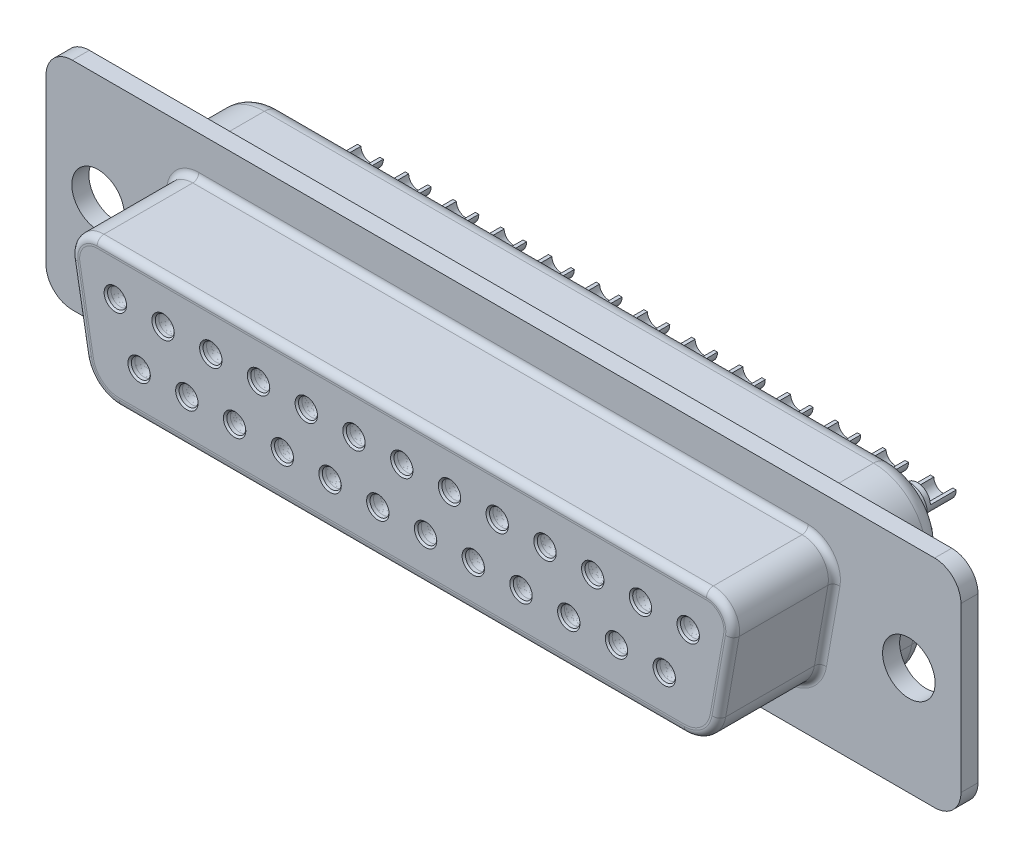
from build123d import *

# Parameters (mm, degrees)
SKETCH3_R                   = 1.524
FLANGE_DEPTH                = 0.99
FRONT_STEEL_HOUSING_DEPTH   = 5.9
FILLET1_R                   = 0.4
FILLET2_R                   = 0.35
REAR_STEEL_HOUSING_DEPTH    = 3.81
INSERT_CUTOUT_DEPTH         = 30.298146963
PLASTIC_INSERT_DEPTH        = 10.7
PLASTIC_INSERT_DEPTH_BACK   = 1.1
FILLET3_R                   = 1
FILLET4_R                   = 0.4
SKETCH9_R                   = 0.55
CUT_EXTRUDE2_DEPTH          = 30.717527075
SKETCH10_R                  = 0.75
SKETCH10_R_2                = 0.55
F_13_SOLDER_PINS_DEPTH      = 3
SOLDER_PIN_SHAPE_DEPTH      = 1.5
LPATTERN1_COUNT             = 13
LPATTERN1_PITCH             = 2.77
SKETCH13_R                  = 0.75
SKETCH13_R_2                = 0.55
F_12_SOLDER_PINS_DEPTH      = 3
F_12_SOLDER_PIN_SHAPE_DEPTH = 1.5
LPATTERN2_COUNT             = 12
LPATTERN2_PITCH             = 2.77
SKETCH15_R                  = 0.75
SKETCH15_R_2                = 0.55
BOSS_EXTRUDE7_DEPTH         = 11.5
BOSS_EXTRUDE7_2_DEPTH       = 11.5
BOSS_EXTRUDE7_3_DEPTH       = 11.5
BOSS_EXTRUDE7_4_DEPTH       = 11.5
BOSS_EXTRUDE7_5_DEPTH       = 11.5
BOSS_EXTRUDE7_6_DEPTH       = 11.5
BOSS_EXTRUDE7_7_DEPTH       = 11.5
BOSS_EXTRUDE7_8_DEPTH       = 11.5
BOSS_EXTRUDE7_9_DEPTH       = 11.5
BOSS_EXTRUDE7_10_DEPTH      = 11.5
BOSS_EXTRUDE7_11_DEPTH      = 11.5
BOSS_EXTRUDE7_12_DEPTH      = 11.5
BOSS_EXTRUDE7_13_DEPTH      = 11.5
BOSS_EXTRUDE7_14_DEPTH      = 11.5
BOSS_EXTRUDE7_15_DEPTH      = 11.5
BOSS_EXTRUDE7_16_DEPTH      = 11.5
BOSS_EXTRUDE7_17_DEPTH      = 11.5
BOSS_EXTRUDE7_18_DEPTH      = 11.5
BOSS_EXTRUDE7_19_DEPTH      = 11.5
BOSS_EXTRUDE7_20_DEPTH      = 11.5
BOSS_EXTRUDE7_21_DEPTH      = 11.5
BOSS_EXTRUDE7_22_DEPTH      = 11.5
BOSS_EXTRUDE7_23_DEPTH      = 11.5
BOSS_EXTRUDE7_24_DEPTH      = 11.5
BOSS_EXTRUDE7_25_DEPTH      = 11.5
CHAMFER1_SIZE               = 0.1


with BuildPart() as part:
    # Sketch3 → Flange (new body)
    with BuildSketch(Plane.XY):
        with BuildLine():
            Line((25.019, 6.2738), (-25.019, 6.2738))
            ThreePointArc((-25.019, 6.2738), (-26.096630735, 5.827430735), (-26.543, 4.7498))
            Line((-26.543, 4.7498), (-26.543, -4.7498))
            ThreePointArc((-26.543, -4.7498), (-26.096630735, -5.827430735), (-25.019, -6.2738))
            Line((-25.019, -6.2738), (25.019, -6.2738))
            ThreePointArc((25.019, -6.2738), (26.096630735, -5.827430735), (26.543, -4.7498))
            Line((26.543, -4.7498), (26.543, 4.7498))
            ThreePointArc((26.543, 4.7498), (26.096630735, 5.827430735), (25.019, 6.2738))
        make_face()
        with Locations((-23.5204, 0)):
            Circle(SKETCH3_R, mode=Mode.SUBTRACT)
        with Locations((23.5204, 0)):
            Circle(SKETCH3_R, mode=Mode.SUBTRACT)
    extrude(amount=FLANGE_DEPTH)

    # Sketch5 → Front Steel Housing (add)
    with BuildSketch(Plane.XY.offset(6.89)):
        with BuildLine():
            Line((17.676152984, 3.9497), (-17.676152984, 3.9497))
            ThreePointArc((-17.676152984, 3.9497), (-18.753783719, 3.503330735), (-19.200152984, 2.4257))
            ThreePointArc((-19.200152984, 2.4257), (-19.194353704, 2.292874648), (-19.177, 2.161060177))
            Line((-19.177, 2.161060177), (-18.395587012, -2.270553097))
            ThreePointArc((-18.395587012, -2.270553097), (-17.70060208, -3.474302308), (-16.394457658, -3.9497))
            Line((-16.394457658, -3.9497), (16.394457658, -3.9497))
            ThreePointArc((16.394457658, -3.9497), (17.70060208, -3.474302308), (18.395587012, -2.270553097))
            Line((18.395587012, -2.270553097), (19.177, 2.161060177))
            ThreePointArc((19.177, 2.161060177), (18.843604716, 3.405308317), (17.676152984, 3.9497))
        make_face()
    extrude(amount=-FRONT_STEEL_HOUSING_DEPTH)

    # Fillet1
    fillet1_edges = [part.edges().sort_by_distance(p)[0] for p in [
        (18.843604716, 3.405308317, 6.89),
        (0, 3.9497, 6.89),
        (-18.843604716, 3.405308317, 6.89),
        (-18.786293506, -0.05474646, 6.89),
        (-17.70060208, -3.474302308, 6.89),
        (0, -3.9497, 6.89),
        (17.70060208, -3.474302308, 6.89),
        (18.786293506, -0.05474646, 6.89),
    ]]
    fillet(fillet1_edges, radius=FILLET1_R)

    # Fillet2
    fillet2_edges = [part.edges().sort_by_distance(p)[0] for p in [
        (18.843604716, 3.405308317, 0.99),
        (18.786293506, -0.05474646, 0.99),
        (17.70060208, -3.474302308, 0.99),
        (0, -3.9497, 0.99),
        (-17.70060208, -3.474302308, 0.99),
        (-18.786293506, -0.05474646, 0.99),
        (-18.843604716, 3.405308317, 0.99),
        (0, 3.9497, 0.99),
    ]]
    fillet(fillet2_edges, radius=FILLET2_R)

    # Sketch7 → Rear Steel Housing (add)
    with BuildSketch(Plane.XY.offset(-3.81)):
        with BuildLine():
            Line((17.676152984, 5.4737), (-17.676152984, 5.4737))
            ThreePointArc((-17.676152984, 5.4737), (-19.831414453, 4.580961469), (-20.724152984, 2.4257))
            ThreePointArc((-20.724152984, 2.4257), (-20.712554424, 2.160049296), (-20.677847016, 1.896420354))
            Line((-20.677847016, 1.896420354), (-19.896434027, -2.53519292))
            ThreePointArc((-19.896434027, -2.53519292), (-18.680210398, -4.64175404), (-16.394457658, -5.4737))
            Line((-16.394457658, -5.4737), (16.394457658, -5.4737))
            ThreePointArc((16.394457658, -5.4737), (18.680210398, -4.64175404), (19.896434027, -2.53519292))
            Line((19.896434027, -2.53519292), (20.677847016, 1.896420354))
            ThreePointArc((20.677847016, 1.896420354), (20.712554424, 2.160049296), (20.724152984, 2.4257))
            ThreePointArc((20.724152984, 2.4257), (19.831414453, 4.580961469), (17.676152984, 5.4737))
        make_face()
    extrude(amount=REAR_STEEL_HOUSING_DEPTH)

    # Sketch6 → Insert Cutout (cut, through all)
    with BuildSketch(Plane.XY.offset(6.89)):
        with BuildLine():
            Line((17.676152984, 3.4417), (-17.676152984, 3.4417))
            ThreePointArc((-17.676152984, 3.4417), (-18.394573474, 3.14412049), (-18.692152984, 2.4257))
            ThreePointArc((-18.692152984, 2.4257), (-18.688286798, 2.337149765), (-18.676717661, 2.249273451))
            Line((-18.676717661, 2.249273451), (-17.895304673, -2.182339823))
            ThreePointArc((-17.895304673, -2.182339823), (-17.374065975, -3.085151731), (-16.394457658, -3.4417))
            Line((-16.394457658, -3.4417), (16.394457658, -3.4417))
            ThreePointArc((16.394457658, -3.4417), (17.374065975, -3.085151731), (17.895304673, -2.182339823))
            Line((17.895304673, -2.182339823), (18.676717661, 2.249273451))
            ThreePointArc((18.676717661, 2.249273451), (18.454454139, 3.078772211), (17.676152984, 3.4417))
        make_face()
    extrude(amount=-INSERT_CUTOUT_DEPTH, mode=Mode.SUBTRACT)

    # Fillet3
    fillet3_edges = [part.edges().sort_by_distance(p)[0] for p in [
        (20.011056447, 4.384916634, -3.81),
        (0, 5.4737, -3.81),
        (-20.011056447, 4.384916634, -3.81),
        (-20.287140521, -0.319386283, -3.81),
        (-18.680210398, -4.64175404, -3.81),
        (0, -5.4737, -3.81),
        (18.680210398, -4.64175404, -3.81),
        (20.287140521, -0.319386283, -3.81),
    ]]
    fillet(fillet3_edges, radius=FILLET3_R)

    # Fillet4
    fillet4_edges = [part.edges().sort_by_distance(p)[0] for p in [
        (20.011056447, 4.384916634, 0),
        (0, 5.4737, 0),
        (-20.011056447, 4.384916634, 0),
        (-20.287140521, -0.319386283, 0),
        (-18.680210398, -4.64175404, 0),
        (0, -5.4737, 0),
        (18.680210398, -4.64175404, 0),
        (20.287140521, -0.319386283, 0),
    ]]
    fillet(fillet4_edges, radius=FILLET4_R)


with BuildPart() as body_2:
    # Sketch8 → Plastic Insert (new, two sides: drawn at the far end of the back side and taken through both)
    with BuildSketch(Plane.XY.offset(-3.81).offset(-PLASTIC_INSERT_DEPTH_BACK)):
        with BuildLine():
            Line((17.676152984, 3.4417), (-17.676152984, 3.4417))
            ThreePointArc((-17.676152984, 3.4417), (-18.394573474, 3.14412049), (-18.692152984, 2.4257))
            ThreePointArc((-18.692152984, 2.4257), (-18.688286798, 2.337149765), (-18.676717661, 2.249273451))
            Line((-18.676717661, 2.249273451), (-17.895304673, -2.182339823))
            ThreePointArc((-17.895304673, -2.182339823), (-17.374065975, -3.085151731), (-16.394457658, -3.4417))
            Line((-16.394457658, -3.4417), (16.394457658, -3.4417))
            ThreePointArc((16.394457658, -3.4417), (17.374065975, -3.085151731), (17.895304673, -2.182339823))
            Line((17.895304673, -2.182339823), (18.676717661, 2.249273451))
            ThreePointArc((18.676717661, 2.249273451), (18.454454139, 3.078772211), (17.676152984, 3.4417))
        make_face()
    extrude(amount=PLASTIC_INSERT_DEPTH + PLASTIC_INSERT_DEPTH_BACK)

    # Sketch9 → Cut-Extrude2 (cut, through all)
    with BuildSketch(Plane.XY.offset(6.89)):
        with Locations((0, 1.42)):
            Circle(SKETCH9_R)
        with Locations((2.77, 1.42)):
            Circle(SKETCH9_R)
        with Locations((5.54, 1.42)):
            Circle(SKETCH9_R)
        with Locations((8.31, 1.42)):
            Circle(SKETCH9_R)
        with Locations((11.08, 1.42)):
            Circle(SKETCH9_R)
        with Locations((13.85, 1.42)):
            Circle(SKETCH9_R)
        with Locations((16.62, 1.42)):
            Circle(SKETCH9_R)
        with Locations((-2.77, 1.42)):
            Circle(SKETCH9_R)
        with Locations((-5.54, 1.42)):
            Circle(SKETCH9_R)
        with Locations((-8.31, 1.42)):
            Circle(SKETCH9_R)
        with Locations((-11.08, 1.42)):
            Circle(SKETCH9_R)
        with Locations((-13.85, 1.42)):
            Circle(SKETCH9_R)
        with Locations((-16.62, 1.42)):
            Circle(SKETCH9_R)
        with Locations((1.38, -1.42)):
            Circle(SKETCH9_R)
        with Locations((4.15, -1.42)):
            Circle(SKETCH9_R)
        with Locations((6.92, -1.42)):
            Circle(SKETCH9_R)
        with Locations((9.69, -1.42)):
            Circle(SKETCH9_R)
        with Locations((12.46, -1.42)):
            Circle(SKETCH9_R)
        with Locations((15.23, -1.42)):
            Circle(SKETCH9_R)
        with Locations((-1.39, -1.42)):
            Circle(SKETCH9_R)
        with Locations((-4.16, -1.42)):
            Circle(SKETCH9_R)
        with Locations((-6.93, -1.42)):
            Circle(SKETCH9_R)
        with Locations((-9.7, -1.42)):
            Circle(SKETCH9_R)
        with Locations((-12.47, -1.42)):
            Circle(SKETCH9_R)
        with Locations((-15.24, -1.42)):
            Circle(SKETCH9_R)
    extrude(amount=-CUT_EXTRUDE2_DEPTH, mode=Mode.SUBTRACT)

    # Sketch10 → 13 Solder Pins (add)
    with BuildSketch(Plane.XY.offset(-4.91)):
        with Locations((16.62, 1.42)):
            Circle(SKETCH10_R)
        with Locations((16.62, 1.42)):
            Circle(SKETCH10_R_2, mode=Mode.SUBTRACT)
    f_13_solder_pins = extrude(amount=-F_13_SOLDER_PINS_DEPTH)

    # Sketch12 → Solder Pin Shape (cut)
    with BuildSketch(Plane(origin=(0, 0, -7.91), x_dir=(-1, 0, 0), z_dir=(0, 0, -1))):
        with BuildLine():
            Line((-17.37, 1.42), (-15.87, 1.42))
            ThreePointArc((-15.87, 1.42), (-16.62, 2.17), (-17.37, 1.42))
        make_face()
    solder_pin_shape = extrude(amount=-SOLDER_PIN_SHAPE_DEPTH, mode=Mode.SUBTRACT)

    # LPattern1: 13 Solder Pins, Solder Pin Shape ×13
    with Locations(*[(-i * LPATTERN1_PITCH, 0, 0) for i in range(1, LPATTERN1_COUNT)]):
        add(f_13_solder_pins)
        add(solder_pin_shape, mode=Mode.SUBTRACT)

    # Sketch13 → 12 Solder Pins (add)
    with BuildSketch(Plane.XY.offset(-4.91)):
        with Locations((15.23, -1.42)):
            Circle(SKETCH13_R)
        with Locations((15.23, -1.42)):
            Circle(SKETCH13_R_2, mode=Mode.SUBTRACT)
    f_12_solder_pins = extrude(amount=-F_12_SOLDER_PINS_DEPTH)

    # Sketch14 → 12 Solder Pin Shape (cut)
    with BuildSketch(Plane(origin=(0, 0, -7.91), x_dir=(-1, 0, 0), z_dir=(0, 0, -1))):
        with BuildLine():
            Line((-15.98, -1.42), (-14.48, -1.42))
            ThreePointArc((-14.48, -1.42), (-15.23, -2.17), (-15.98, -1.42))
        make_face()
    f_12_solder_pin_shape = extrude(amount=-F_12_SOLDER_PIN_SHAPE_DEPTH, mode=Mode.SUBTRACT)

    # LPattern2: 12 Solder Pins, 12 Solder Pin Shape ×12
    with Locations(*[(-i * LPATTERN2_PITCH, 0, 0) for i in range(1, LPATTERN2_COUNT)]):
        add(f_12_solder_pins)
        add(f_12_solder_pin_shape, mode=Mode.SUBTRACT)

    # Chamfer1
    chamfer1_edges = [body_2.edges().sort_by_distance(p)[0] for p in [
        (0.83, -1.42, 6.89),
        (3.6, -1.42, 6.89),
        (6.37, -1.42, 6.89),
        (9.14, -1.42, 6.89),
        (11.91, -1.42, 6.89),
        (14.68, -1.42, 6.89),
        (-1.94, -1.42, 6.89),
        (-4.71, -1.42, 6.89),
        (-7.48, -1.42, 6.89),
        (-10.25, -1.42, 6.89),
        (-13.02, -1.42, 6.89),
        (-15.79, -1.42, 6.89),
        (-0.55, 1.42, 6.89),
        (2.22, 1.42, 6.89),
        (4.99, 1.42, 6.89),
        (7.76, 1.42, 6.89),
        (10.53, 1.42, 6.89),
        (13.3, 1.42, 6.89),
        (16.07, 1.42, 6.89),
        (-3.32, 1.42, 6.89),
        (-6.09, 1.42, 6.89),
        (-8.86, 1.42, 6.89),
        (-11.63, 1.42, 6.89),
        (-14.4, 1.42, 6.89),
        (-17.17, 1.42, 6.89),
    ]]
    chamfer(chamfer1_edges, length=CHAMFER1_SIZE)


with BuildPart() as body_3:
    # Sketch15 → Boss-Extrude7 (new body)
    with BuildSketch(Plane.XY.offset(-4.91)):
        with Locations((16.62, 1.42)):
            Circle(SKETCH15_R)
        with Locations((16.62, 1.42)):
            Circle(SKETCH15_R_2, mode=Mode.SUBTRACT)
    extrude(amount=BOSS_EXTRUDE7_DEPTH)


with BuildPart() as body_4:
    # Sketch15 → Boss-Extrude7 2 (new body)
    with BuildSketch(Plane.XY.offset(-4.91)):
        with Locations((13.85, 1.42)):
            Circle(SKETCH15_R)
        with Locations((13.85, 1.42)):
            Circle(SKETCH15_R_2, mode=Mode.SUBTRACT)
    extrude(amount=BOSS_EXTRUDE7_2_DEPTH)


with BuildPart() as body_5:
    # Sketch15 → Boss-Extrude7 3 (new body)
    with BuildSketch(Plane.XY.offset(-4.91)):
        with Locations((11.08, 1.42)):
            Circle(SKETCH15_R)
        with Locations((11.08, 1.42)):
            Circle(SKETCH15_R_2, mode=Mode.SUBTRACT)
    extrude(amount=BOSS_EXTRUDE7_3_DEPTH)


with BuildPart() as body_6:
    # Sketch15 → Boss-Extrude7 4 (new body)
    with BuildSketch(Plane.XY.offset(-4.91)):
        with Locations((8.31, 1.42)):
            Circle(SKETCH15_R)
        with Locations((8.31, 1.42)):
            Circle(SKETCH15_R_2, mode=Mode.SUBTRACT)
    extrude(amount=BOSS_EXTRUDE7_4_DEPTH)


with BuildPart() as body_7:
    # Sketch15 → Boss-Extrude7 5 (new body)
    with BuildSketch(Plane.XY.offset(-4.91)):
        with Locations((5.54, 1.42)):
            Circle(SKETCH15_R)
        with Locations((5.54, 1.42)):
            Circle(SKETCH15_R_2, mode=Mode.SUBTRACT)
    extrude(amount=BOSS_EXTRUDE7_5_DEPTH)


with BuildPart() as body_8:
    # Sketch15 → Boss-Extrude7 6 (new body)
    with BuildSketch(Plane.XY.offset(-4.91)):
        with Locations((2.77, 1.42)):
            Circle(SKETCH15_R)
        with Locations((2.77, 1.42)):
            Circle(SKETCH15_R_2, mode=Mode.SUBTRACT)
    extrude(amount=BOSS_EXTRUDE7_6_DEPTH)


with BuildPart() as body_9:
    # Sketch15 → Boss-Extrude7 7 (new body)
    with BuildSketch(Plane.XY.offset(-4.91)):
        with Locations((0, 1.42)):
            Circle(SKETCH15_R)
        with Locations((0, 1.42)):
            Circle(SKETCH15_R_2, mode=Mode.SUBTRACT)
    extrude(amount=BOSS_EXTRUDE7_7_DEPTH)


with BuildPart() as body_10:
    # Sketch15 → Boss-Extrude7 8 (new body)
    with BuildSketch(Plane.XY.offset(-4.91)):
        with Locations((-2.77, 1.42)):
            Circle(SKETCH15_R)
        with Locations((-2.77, 1.42)):
            Circle(SKETCH15_R_2, mode=Mode.SUBTRACT)
    extrude(amount=BOSS_EXTRUDE7_8_DEPTH)


with BuildPart() as body_11:
    # Sketch15 → Boss-Extrude7 9 (new body)
    with BuildSketch(Plane.XY.offset(-4.91)):
        with Locations((-5.54, 1.42)):
            Circle(SKETCH15_R)
        with Locations((-5.54, 1.42)):
            Circle(SKETCH15_R_2, mode=Mode.SUBTRACT)
    extrude(amount=BOSS_EXTRUDE7_9_DEPTH)


with BuildPart() as body_12:
    # Sketch15 → Boss-Extrude7 10 (new body)
    with BuildSketch(Plane.XY.offset(-4.91)):
        with Locations((-8.31, 1.42)):
            Circle(SKETCH15_R)
        with Locations((-8.31, 1.42)):
            Circle(SKETCH15_R_2, mode=Mode.SUBTRACT)
    extrude(amount=BOSS_EXTRUDE7_10_DEPTH)


with BuildPart() as body_13:
    # Sketch15 → Boss-Extrude7 11 (new body)
    with BuildSketch(Plane.XY.offset(-4.91)):
        with Locations((-11.08, 1.42)):
            Circle(SKETCH15_R)
        with Locations((-11.08, 1.42)):
            Circle(SKETCH15_R_2, mode=Mode.SUBTRACT)
    extrude(amount=BOSS_EXTRUDE7_11_DEPTH)


with BuildPart() as body_14:
    # Sketch15 → Boss-Extrude7 12 (new body)
    with BuildSketch(Plane.XY.offset(-4.91)):
        with Locations((-13.85, 1.42)):
            Circle(SKETCH15_R)
        with Locations((-13.85, 1.42)):
            Circle(SKETCH15_R_2, mode=Mode.SUBTRACT)
    extrude(amount=BOSS_EXTRUDE7_12_DEPTH)


with BuildPart() as body_15:
    # Sketch15 → Boss-Extrude7 13 (new body)
    with BuildSketch(Plane.XY.offset(-4.91)):
        with Locations((-16.62, 1.42)):
            Circle(SKETCH15_R)
        with Locations((-16.62, 1.42)):
            Circle(SKETCH15_R_2, mode=Mode.SUBTRACT)
    extrude(amount=BOSS_EXTRUDE7_13_DEPTH)


with BuildPart() as body_16:
    # Sketch15 → Boss-Extrude7 14 (new body)
    with BuildSketch(Plane.XY.offset(-4.91)):
        with Locations((15.23, -1.42)):
            Circle(SKETCH15_R)
        with Locations((15.23, -1.42)):
            Circle(SKETCH15_R_2, mode=Mode.SUBTRACT)
    extrude(amount=BOSS_EXTRUDE7_14_DEPTH)


with BuildPart() as body_17:
    # Sketch15 → Boss-Extrude7 15 (new body)
    with BuildSketch(Plane.XY.offset(-4.91)):
        with Locations((12.46, -1.42)):
            Circle(SKETCH15_R)
        with Locations((12.46, -1.42)):
            Circle(SKETCH15_R_2, mode=Mode.SUBTRACT)
    extrude(amount=BOSS_EXTRUDE7_15_DEPTH)


with BuildPart() as body_18:
    # Sketch15 → Boss-Extrude7 16 (new body)
    with BuildSketch(Plane.XY.offset(-4.91)):
        with Locations((9.69, -1.42)):
            Circle(SKETCH15_R)
        with Locations((9.69, -1.42)):
            Circle(SKETCH15_R_2, mode=Mode.SUBTRACT)
    extrude(amount=BOSS_EXTRUDE7_16_DEPTH)


with BuildPart() as body_19:
    # Sketch15 → Boss-Extrude7 17 (new body)
    with BuildSketch(Plane.XY.offset(-4.91)):
        with Locations((6.92, -1.42)):
            Circle(SKETCH15_R)
        with Locations((6.92, -1.42)):
            Circle(SKETCH15_R_2, mode=Mode.SUBTRACT)
    extrude(amount=BOSS_EXTRUDE7_17_DEPTH)


with BuildPart() as body_20:
    # Sketch15 → Boss-Extrude7 18 (new body)
    with BuildSketch(Plane.XY.offset(-4.91)):
        with Locations((4.15, -1.42)):
            Circle(SKETCH15_R)
        with Locations((4.15, -1.42)):
            Circle(SKETCH15_R_2, mode=Mode.SUBTRACT)
    extrude(amount=BOSS_EXTRUDE7_18_DEPTH)


with BuildPart() as body_21:
    # Sketch15 → Boss-Extrude7 19 (new body)
    with BuildSketch(Plane.XY.offset(-4.91)):
        with Locations((1.38, -1.42)):
            Circle(SKETCH15_R)
        with Locations((1.38, -1.42)):
            Circle(SKETCH15_R_2, mode=Mode.SUBTRACT)
    extrude(amount=BOSS_EXTRUDE7_19_DEPTH)


with BuildPart() as body_22:
    # Sketch15 → Boss-Extrude7 20 (new body)
    with BuildSketch(Plane.XY.offset(-4.91)):
        with Locations((-1.39, -1.42)):
            Circle(SKETCH15_R)
        with Locations((-1.39, -1.42)):
            Circle(SKETCH15_R_2, mode=Mode.SUBTRACT)
    extrude(amount=BOSS_EXTRUDE7_20_DEPTH)


with BuildPart() as body_23:
    # Sketch15 → Boss-Extrude7 21 (new body)
    with BuildSketch(Plane.XY.offset(-4.91)):
        with Locations((-4.16, -1.42)):
            Circle(SKETCH15_R)
        with Locations((-4.16, -1.42)):
            Circle(SKETCH15_R_2, mode=Mode.SUBTRACT)
    extrude(amount=BOSS_EXTRUDE7_21_DEPTH)


with BuildPart() as body_24:
    # Sketch15 → Boss-Extrude7 22 (new body)
    with BuildSketch(Plane.XY.offset(-4.91)):
        with Locations((-6.93, -1.42)):
            Circle(SKETCH15_R)
        with Locations((-6.93, -1.42)):
            Circle(SKETCH15_R_2, mode=Mode.SUBTRACT)
    extrude(amount=BOSS_EXTRUDE7_22_DEPTH)


with BuildPart() as body_25:
    # Sketch15 → Boss-Extrude7 23 (new body)
    with BuildSketch(Plane.XY.offset(-4.91)):
        with Locations((-9.7, -1.42)):
            Circle(SKETCH15_R)
        with Locations((-9.7, -1.42)):
            Circle(SKETCH15_R_2, mode=Mode.SUBTRACT)
    extrude(amount=BOSS_EXTRUDE7_23_DEPTH)


with BuildPart() as body_26:
    # Sketch15 → Boss-Extrude7 24 (new body)
    with BuildSketch(Plane.XY.offset(-4.91)):
        with Locations((-12.47, -1.42)):
            Circle(SKETCH15_R)
        with Locations((-12.47, -1.42)):
            Circle(SKETCH15_R_2, mode=Mode.SUBTRACT)
    extrude(amount=BOSS_EXTRUDE7_24_DEPTH)


with BuildPart() as body_27:
    # Sketch15 → Boss-Extrude7 25 (new body)
    with BuildSketch(Plane.XY.offset(-4.91)):
        with Locations((-15.24, -1.42)):
            Circle(SKETCH15_R)
        with Locations((-15.24, -1.42)):
            Circle(SKETCH15_R_2, mode=Mode.SUBTRACT)
    extrude(amount=BOSS_EXTRUDE7_25_DEPTH)


solid = Compound([part.part, body_2.part, body_3.part, body_4.part, body_5.part, body_6.part, body_7.part, body_8.part, body_9.part, body_10.part, body_11.part, body_12.part, body_13.part, body_14.part, body_15.part, body_16.part, body_17.part, body_18.part, body_19.part, body_20.part, body_21.part, body_22.part, body_23.part, body_24.part, body_25.part, body_26.part, body_27.part])
